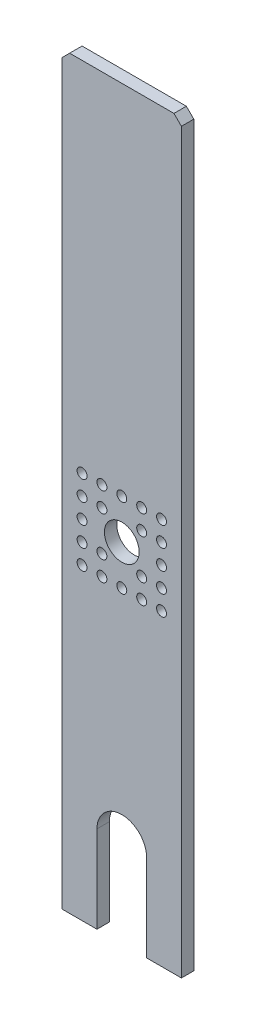
from build123d import *

# Parameters (mm, degrees)
SKETCH1_W           = 48
SKETCH1_H           = 300
SKETCH1_R           = 7
SKETCH1_R_2         = 2
BOSS_EXTRUDE1_DEPTH = 5
CHAMFER1_SIZE       = 3
CUT_EXTRUDE1_DEPTH  = 304.856874202


with BuildPart() as part:
    # Sketch1 → Boss-Extrude1 (new body)
    with BuildSketch(Plane.XY):
        with Locations((24, -150)):
            Rectangle(SKETCH1_W, SKETCH1_H)
        with Locations((24, -160)):
            Circle(SKETCH1_R, mode=Mode.SUBTRACT)
        with Locations((8, -144)):
            Circle(SKETCH1_R_2, mode=Mode.SUBTRACT)
        with Locations((16, -144)):
            Circle(SKETCH1_R_2, mode=Mode.SUBTRACT)
        with Locations((24, -144)):
            Circle(SKETCH1_R_2, mode=Mode.SUBTRACT)
        with Locations((32, -144)):
            Circle(SKETCH1_R_2, mode=Mode.SUBTRACT)
        with Locations((40, -144)):
            Circle(SKETCH1_R_2, mode=Mode.SUBTRACT)
        with Locations((16, -152)):
            Circle(SKETCH1_R_2, mode=Mode.SUBTRACT)
        with Locations((32, -152)):
            Circle(SKETCH1_R_2, mode=Mode.SUBTRACT)
        with Locations((40, -152)):
            Circle(SKETCH1_R_2, mode=Mode.SUBTRACT)
        with Locations((40, -160)):
            Circle(SKETCH1_R_2, mode=Mode.SUBTRACT)
        with Locations((16, -168)):
            Circle(SKETCH1_R_2, mode=Mode.SUBTRACT)
        with Locations((32, -168)):
            Circle(SKETCH1_R_2, mode=Mode.SUBTRACT)
        with Locations((40, -168)):
            Circle(SKETCH1_R_2, mode=Mode.SUBTRACT)
        with Locations((16, -176)):
            Circle(SKETCH1_R_2, mode=Mode.SUBTRACT)
        with Locations((24, -176)):
            Circle(SKETCH1_R_2, mode=Mode.SUBTRACT)
        with Locations((32, -176)):
            Circle(SKETCH1_R_2, mode=Mode.SUBTRACT)
        with Locations((40, -176)):
            Circle(SKETCH1_R_2, mode=Mode.SUBTRACT)
        with Locations((8, -152)):
            Circle(SKETCH1_R_2, mode=Mode.SUBTRACT)
        with Locations((8, -160)):
            Circle(SKETCH1_R_2, mode=Mode.SUBTRACT)
        with Locations((8, -168)):
            Circle(SKETCH1_R_2, mode=Mode.SUBTRACT)
        with Locations((8, -176)):
            Circle(SKETCH1_R_2, mode=Mode.SUBTRACT)
    extrude(amount=BOSS_EXTRUDE1_DEPTH)

    # Chamfer1
    chamfer1_edges = [part.edges().sort_by_distance(p)[0] for p in [
        (48, 0, 2.5),
        (0, 0, 2.5),
    ]]
    chamfer(chamfer1_edges, length=CHAMFER1_SIZE)

    # Sketch2 → Cut-Extrude1 (cut, through all)
    with BuildSketch(Plane.XY.offset(5)):
        with BuildLine():
            Line((14, -265), (14, -300))
            Line((14, -300), (34, -300))
            Line((34, -300), (34, -265))
            ThreePointArc((34, -265), (24, -255), (14, -265))
        make_face()
    extrude(amount=-CUT_EXTRUDE1_DEPTH, mode=Mode.SUBTRACT)


solid = part.part
